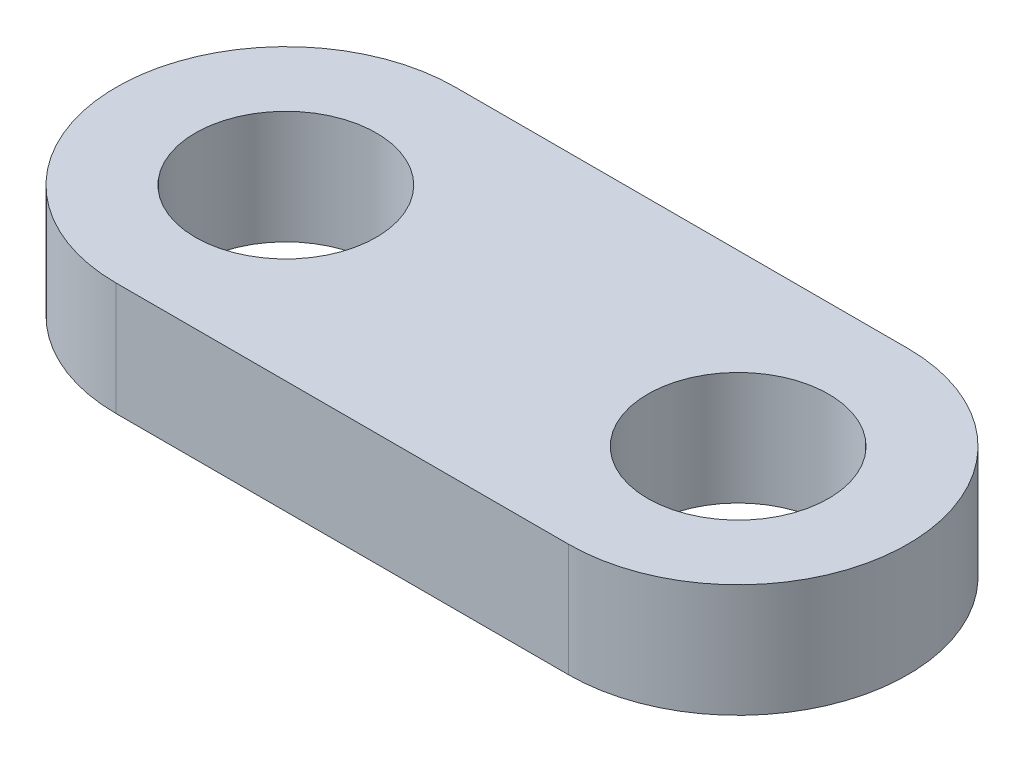
from build123d import *

# Parameters (mm, degrees)
SKETCH1_R           = 4
BOSS_EXTRUDE1_DEPTH = 5


with BuildPart() as part:
    # Sketch1 → Boss-Extrude1 (new body)
    with BuildSketch(Plane(origin=(0, 0, 0), x_dir=(1, 0, 0), z_dir=(0, 1, 0))):
        with BuildLine():
            Line((-10, -7.5), (10, -7.5))
            ThreePointArc((10, -7.5), (17.5, 0), (10, 7.5))
            Line((10, 7.5), (-10, 7.5))
            ThreePointArc((-10, 7.5), (-17.5, 0), (-10, -7.5))
        make_face()
        with Locations(Location((-10, 0, 0), (0, 0, 270))):
            Circle(SKETCH1_R, mode=Mode.SUBTRACT)
        with Locations(Location((10, 0, 0), (0, 0, 270))):
            Circle(SKETCH1_R, mode=Mode.SUBTRACT)
    extrude(amount=BOSS_EXTRUDE1_DEPTH)


solid = part.part
